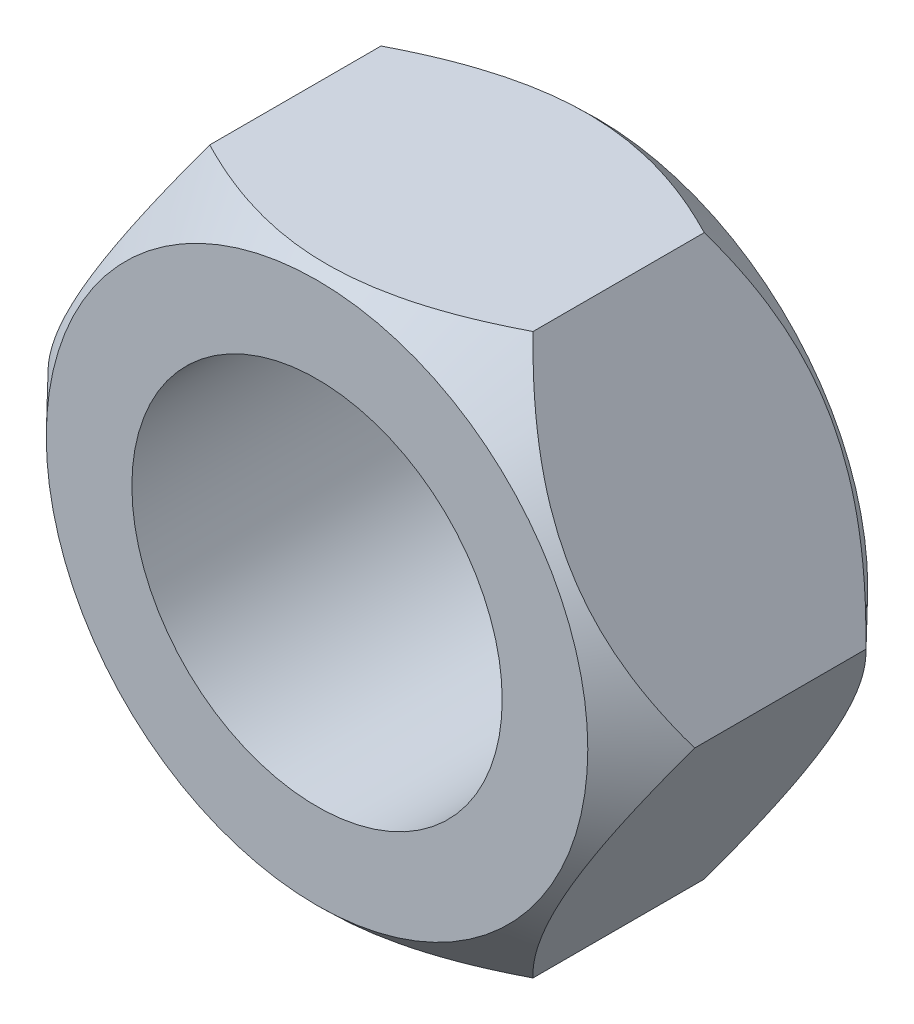
from build123d import *

# Parameters (mm, degrees)
CROQUIS1_R              = 7.9375
SALIENTE_EXTRUIR1_DEPTH = 12
CROQUIS2_R              = 26.020847396
CROQUIS2_R_2            = 11.607184101
CORTAR_EXTRUIR1_DEPTH   = 11
CORTAR_EXTRUIR1_DRAFT   = -44
CROQUIS3_R              = 34.266394572
CROQUIS3_R_2            = 11.607184101
CORTAR_EXTRUIR2_DEPTH   = 11
CORTAR_EXTRUIR2_DRAFT   = -44


with BuildPart() as part:
    # Croquis1 → Saliente-Extruir1 (new body)
    with BuildSketch(Plane.XY):
        Polygon((13.856406461, 0), (6.92820323, 12), (-6.92820323, 12), (-13.856406461, 0), (-6.92820323, -12), (6.92820323, -12), align=None)
        Circle(CROQUIS1_R, mode=Mode.SUBTRACT)
    extrude(amount=SALIENTE_EXTRUIR1_DEPTH)


with BuildPart() as cortar_extruir1_tool:
    # Croquis2 → Cortar-Extruir1 (with draft: the straight prism first)
    with BuildSketch(Plane.XY.offset(12)):
        Circle(CROQUIS2_R)
        Circle(CROQUIS2_R_2, mode=Mode.SUBTRACT)
    extrude(amount=-CORTAR_EXTRUIR1_DEPTH)
    # Cortar-Extruir1: the draft: its side faces are tilted about the plane it starts from
    cortar_extruir1_sides = [cortar_extruir1_tool.faces().sort_by_distance(p)[0] for p in [
        (-26.020847396, 0, 6.5),
        (-11.607184101, 0, 6.5),
    ]]
    draft(cortar_extruir1_sides, Plane.XY.offset(12), CORTAR_EXTRUIR1_DRAFT)


with BuildPart() as part_1:
    add(part.part)

    # Cortar-Extruir1: cut by cortar_extruir1_tool
    add(cortar_extruir1_tool.part, mode=Mode.SUBTRACT)


with BuildPart() as cortar_extruir2_tool:
    # Croquis3 → Cortar-Extruir2 (with draft: the straight prism first)
    with BuildSketch(Plane(origin=(0, 0, 0), x_dir=(-1, 0, 0), z_dir=(0, 0, -1))):
        Circle(CROQUIS3_R)
        Circle(CROQUIS3_R_2, mode=Mode.SUBTRACT)
    extrude(amount=-CORTAR_EXTRUIR2_DEPTH)
    # Cortar-Extruir2: the draft: its side faces are tilted about the plane it starts from
    cortar_extruir2_sides = [cortar_extruir2_tool.faces().sort_by_distance(p)[0] for p in [
        (34.266394572, 0, 5.5),
        (11.607184101, 0, 5.5),
    ]]
    draft(cortar_extruir2_sides, Plane(origin=(0, 0, 0), x_dir=(-1, 0, 0), z_dir=(0, 0, -1)), CORTAR_EXTRUIR2_DRAFT)


with BuildPart() as part_2:
    add(part_1.part)

    # Cortar-Extruir2: cut by cortar_extruir2_tool
    add(cortar_extruir2_tool.part, mode=Mode.SUBTRACT)


solid = part_2.part
